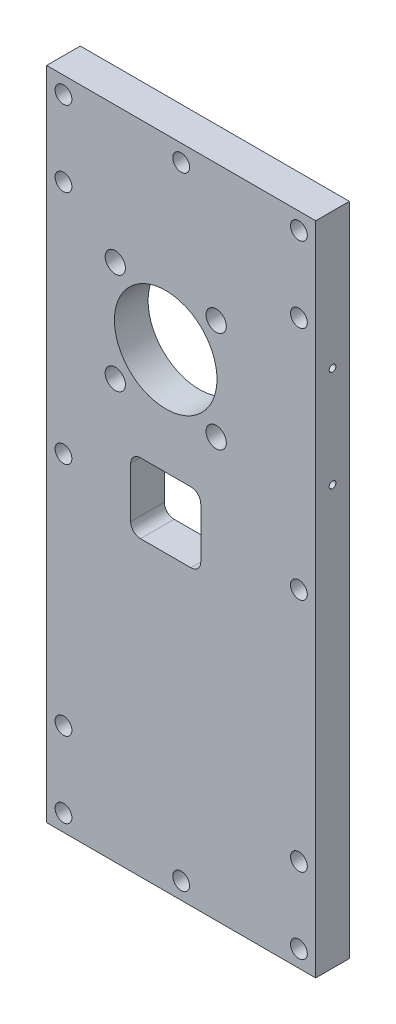
from build123d import *

# Parameters (mm, degrees)
SKIZZE1_W                       = 80
SKIZZE1_H                       = 195
AUFSATZ_LINEAR_AUSTRAGEN1_DEPTH = 10
SKIZZE2_R                       = 3.015
SKIZZE2_R_2                     = 15.25
SCHNITT_LINEAR_AUSTRAGEN1_DEPTH = 10
SKIZZE3_R                       = 1.25
SCHNITT_LINEAR_AUSTRAGEN2_DEPTH = 5
SKIZZE4_R                       = 2.5
SCHNITT_LINEAR_AUSTRAGEN3_DEPTH = 5
SKIZZE5_R                       = 1
SCHNITT_LINEAR_AUSTRAGEN4_DEPTH = 20
SCHNITT_LINEAR_START            = -30
SKIZZE6_R                       = 1
SCHNITT_LINEAR_AUSTRAGEN5_DEPTH = 30


with BuildPart() as part:
    # Skizze1 → Aufsatz-Linear austragen1 (new body)
    with BuildSketch(Plane.XY):
        with Locations((-29.059385344, -27.400468384)):
            Rectangle(SKIZZE1_W, SKIZZE1_H)
    extrude(amount=-AUFSATZ_LINEAR_AUSTRAGEN1_DEPTH)

    # Skizze2 → Schnitt-Linear austragen1 (cut)
    with BuildSketch(Plane(origin=(0, 0, -10), x_dir=(-1, 0, 0), z_dir=(0, 0, -1))):
        with Locations((18.659385344, 29.599531616)):
            Circle(SKIZZE2_R)
        with Locations((48.659385344, 29.599531616)):
            Circle(SKIZZE2_R)
        with Locations((18.659385344, -0.400468384)):
            Circle(SKIZZE2_R)
        with Locations((48.659385344, -0.400468384)):
            Circle(SKIZZE2_R)
        with Locations((33.659385344, 14.599531616)):
            Circle(SKIZZE2_R_2)
        with BuildLine():
            Line((23.241327633, -19.900468384), (23.241327633, -34.900468384))
            ThreePointArc((23.241327633, -34.900468384), (24.096006948, -36.96384678), (26.159385344, -37.818526095))
            Line((26.159385344, -37.818526095), (41.159385344, -37.818526095))
            ThreePointArc((41.159385344, -37.818526095), (43.22276374, -36.96384678), (44.077443055, -34.900468384))
            Line((44.077443055, -34.900468384), (44.077443055, -19.900468384))
            ThreePointArc((44.077443055, -19.900468384), (43.22276374, -17.837089988), (41.159385344, -16.982410673))
            Line((41.159385344, -16.982410673), (26.159385344, -16.982410673))
            ThreePointArc((26.159385344, -16.982410673), (24.096006948, -17.837089988), (23.241327633, -19.900468384))
        make_face()
    extrude(amount=-SCHNITT_LINEAR_AUSTRAGEN1_DEPTH, mode=Mode.SUBTRACT)

    # Skizze3 → Schnitt-Linear austragen2 (cut)
    with BuildSketch(Plane(origin=(0, 0, -10), x_dir=(-1, 0, 0), z_dir=(0, 0, -1))):
        with Locations((-5.940614656, 65.099531616)):
            Circle(SKIZZE3_R)
        with Locations((63.81594416, 65.099531616)):
            Circle(SKIZZE3_R)
        with Locations((28.937664752, 65.099531616)):
            Circle(SKIZZE3_R)
        with Locations((63.81594416, 42.599531616)):
            Circle(SKIZZE3_R)
        with Locations((63.81594416, -27.400468384)):
            Circle(SKIZZE3_R)
        with Locations((63.81594416, -97.400468384)):
            Circle(SKIZZE3_R)
        with Locations((63.81594416, -119.900468384)):
            Circle(SKIZZE3_R)
        with Locations((28.937664752, -119.900468384)):
            Circle(SKIZZE3_R)
        with Locations((-5.940614656, -119.900468384)):
            Circle(SKIZZE3_R)
        with Locations((-5.940614656, -97.400468384)):
            Circle(SKIZZE3_R)
        with Locations((-5.940614656, -27.400468384)):
            Circle(SKIZZE3_R)
        with Locations((-5.940614656, 42.599531616)):
            Circle(SKIZZE3_R)
    extrude(amount=-SCHNITT_LINEAR_AUSTRAGEN2_DEPTH, mode=Mode.SUBTRACT)

    # Skizze4 → Schnitt-Linear austragen3 (cut)
    with BuildSketch(Plane.XY):
        with Locations((-64.059385344, 65.099531616)):
            Circle(SKIZZE4_R)
        with Locations((5.940614656, 65.099531616)):
            Circle(SKIZZE4_R)
        with Locations((5.940614656, 42.599531616)):
            Circle(SKIZZE4_R)
        with Locations((5.940614656, -27.400468384)):
            Circle(SKIZZE4_R)
        with Locations((5.940614656, -97.400468384)):
            Circle(SKIZZE4_R)
        with Locations((5.940614656, -119.900468384)):
            Circle(SKIZZE4_R)
        with Locations((-64.059385344, -119.900468384)):
            Circle(SKIZZE4_R)
        with Locations((-64.059385344, -97.400468384)):
            Circle(SKIZZE4_R)
        with Locations((-64.059385344, -27.400468384)):
            Circle(SKIZZE4_R)
        with Locations((-64.059385344, 42.599531616)):
            Circle(SKIZZE4_R)
        with Locations((-29.059385344, -119.900468384)):
            Circle(SKIZZE4_R)
        with Locations((-29.059385344, 65.099531616)):
            Circle(SKIZZE4_R)
    extrude(amount=-SCHNITT_LINEAR_AUSTRAGEN3_DEPTH, mode=Mode.SUBTRACT)

    # Skizze5 → Schnitt-Linear austragen4 (cut)
    with BuildSketch(Plane.ZY.offset(69.059385344)):
        with Locations((-5, 29.599531616)):
            Circle(SKIZZE5_R)
        with Locations((-5, -0.400468384)):
            Circle(SKIZZE5_R)
    extrude(amount=-SCHNITT_LINEAR_AUSTRAGEN4_DEPTH, mode=Mode.SUBTRACT)

    # Skizze6 → Schnitt-Linear austragen5 (cut)
    with BuildSketch(Plane(origin=(10.940614656, 0, 0), x_dir=(0, 0, -1), z_dir=(1, 0, 0)).offset(SCHNITT_LINEAR_START)):
        with Locations(Location((5, 29.599531616, 0), (0, 0, 180))):
            Circle(SKIZZE6_R)
        with Locations(Location((5, -0.400468384, 0), (0, 0, 180))):
            Circle(SKIZZE6_R)
    extrude(amount=SCHNITT_LINEAR_AUSTRAGEN5_DEPTH, mode=Mode.SUBTRACT)


solid = part.part
